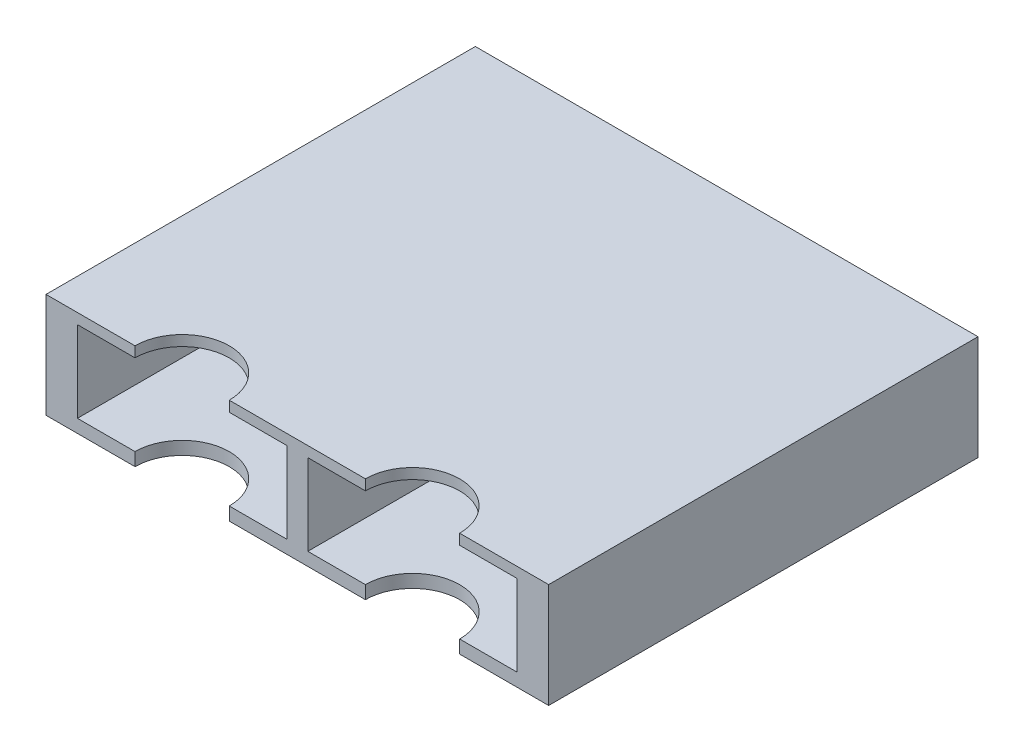
from build123d import *

# Parameters (mm, degrees)
SKETCH_1_W          = 96
SKETCH_1_H          = 20
EXTRUDE_1_DEPTH     = 82
CUT_EXTRUDE_2_DEPTH = 20
SKETCH_3_W          = 40
SKETCH_3_H          = 15.5
CUT_EXTRUDE_3_DEPTH = 76
SKETCH_6_R          = 1.5
CUT_EXTRUDE_5_DEPTH = 10


with BuildPart() as part:
    # 草图1 → 凸台-拉伸1 (new body)
    with BuildSketch(Plane.XY):
        with Locations((48, 10)):
            Rectangle(SKETCH_1_W, SKETCH_1_H)
    extrude(amount=EXTRUDE_1_DEPTH)

    # 草图2 → 切除-拉伸2 (cut)
    with BuildSketch(Plane(origin=(0, 20, 0), x_dir=(1, 0, 0), z_dir=(0, 1, 0))):
        with BuildLine():
            Line((17, -82), (35, -82))
            ThreePointArc((35, -82), (26, -73), (17, -82))
        make_face()
        with BuildLine():
            Line((79, -82), (61, -82))
            ThreePointArc((61, -82), (70, -73), (79, -82))
        make_face()
    extrude(amount=-CUT_EXTRUDE_2_DEPTH, mode=Mode.SUBTRACT)

    # 草图3 → 切除-拉伸3 (cut)
    with BuildSketch(Plane.XY.offset(82)):
        with Locations((26, 10.25)):
            Rectangle(SKETCH_3_W, SKETCH_3_H)
        with Locations((149, 10.25)):
            Rectangle(SKETCH_3_W, SKETCH_3_H)
        with Locations((70, 10.25)):
            Rectangle(SKETCH_3_W, SKETCH_3_H)
    extrude(amount=-CUT_EXTRUDE_3_DEPTH, mode=Mode.SUBTRACT)

    # 草图6 → 切除-拉伸5 (cut)
    with BuildSketch(Plane.XZ):
        with Locations(Location((86, 2.5, 0), (0, 0, 270))):
            Circle(SKETCH_6_R)
        with Locations(Location((10, 2.5, 0), (0, 0, 90))):
            Circle(SKETCH_6_R)
        with Locations(Location((93, 64, 0), (0, 0, 270))):
            Circle(SKETCH_6_R)
        with Locations(Location((3, 64, 0), (0, 0, 90))):
            Circle(SKETCH_6_R)
    extrude(amount=-CUT_EXTRUDE_5_DEPTH, mode=Mode.SUBTRACT)


solid = part.part
